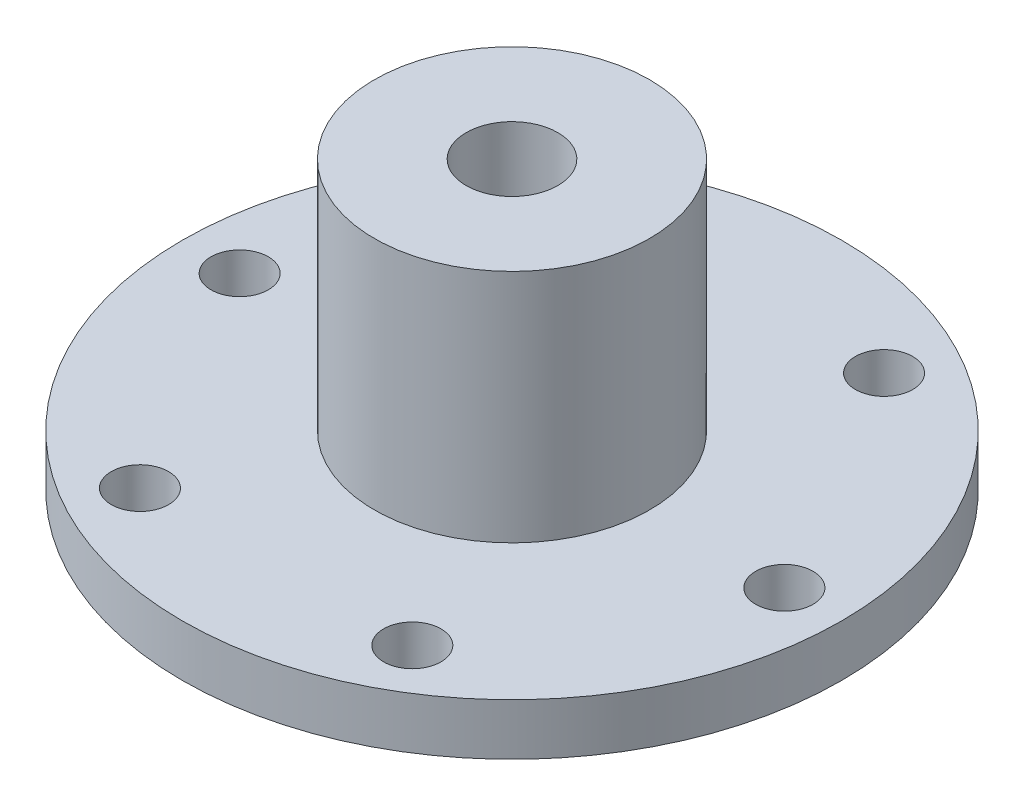
from build123d import *

# Parameters (mm, degrees)
ESQUISSE2_R             = 2.5
ENL_V_MAT_EXTRU_1_DEPTH = 48.72970773


with BuildPart() as part:
    # Esquisse1 → Révolution1 (revolve)
    with BuildSketch(Plane.XY, mode=Mode.PRIVATE) as r_volution1_sk:
        Polygon((4, 0), (28.75, 0), (28.75, 4.5), (12, 4.5), (12, 25), (4, 25), align=None)
    revolve(r_volution1_sk.sketch.rotate(Axis((0, 0, 0), (0, 1, 0)), 90), axis=Axis((0, 0, 0), (0, 1, 0)))

    # Esquisse2 → Enlèv. mat.-Extru.1 (cut, through all)
    with BuildSketch(Plane.XZ):
        with Locations(Location((23.75, 0, 0), (0, 0, 270))):
            Circle(ESQUISSE2_R)
        with Locations(Location((11.875, -20.56810334, 0), (0, 0, 270))):
            Circle(ESQUISSE2_R)
        with Locations(Location((-11.875, -20.56810334, 0), (0, 0, 270))):
            Circle(ESQUISSE2_R)
        with Locations(Location((-23.75, 0, 0), (0, 0, 270))):
            Circle(ESQUISSE2_R)
        with Locations(Location((-11.875, 20.56810334, 0), (0, 0, 270))):
            Circle(ESQUISSE2_R)
        with Locations(Location((11.875, 20.56810334, 0), (0, 0, 270))):
            Circle(ESQUISSE2_R)
    extrude(amount=-ENL_V_MAT_EXTRU_1_DEPTH, mode=Mode.SUBTRACT)


solid = part.part
